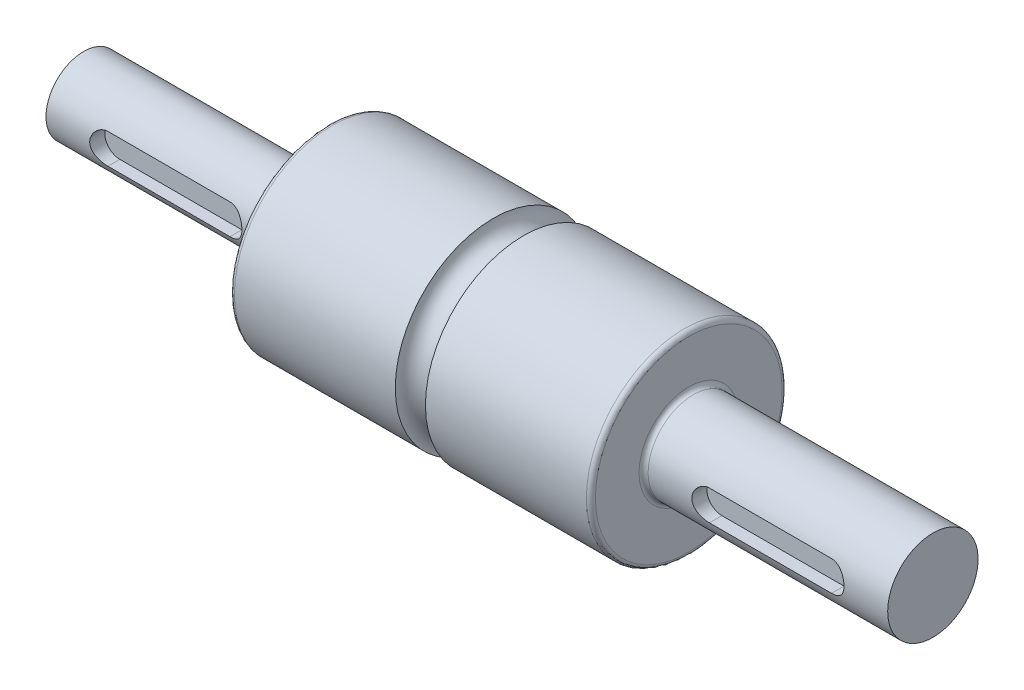
from build123d import *

# Parameters (mm, degrees)
CORTAR_EXTRUIR2_START = 12.5
CORTAR_EXTRUIR2_DEPTH = 5
CORTAR_EXTRUIR3_START = 15
CORTAR_EXTRUIR3_DEPTH = 5


with BuildPart() as part:
    # Croquis4 → Revolución2 (revolve)
    with BuildSketch(Plane(origin=(0, 0, 0), x_dir=(1, 0, 0), z_dir=(0, 1, 0)), mode=Mode.PRIVATE) as revoluci_n2_sk:
        with BuildLine():
            Line((-140.903426942, 0), (-140.903426942, 12.5))
            Line((-140.903426942, 12.5), (-61.403426942, 12.5))
            ThreePointArc((-61.403426942, 12.5), (-60.34276677, 12.939339828), (-59.903426942, 14))
            Line((-59.903426942, 14), (-59.903426942, 31))
            ThreePointArc((-59.903426942, 31), (-59.464087114, 32.060660172), (-58.403426942, 32.5))
            Line((-58.403426942, 32.5), (-5, 32.5))
            ThreePointArc((-5, 32.5), (0, 27.5), (5, 32.5))
            Line((5, 32.5), (58.403426942, 32.5))
            ThreePointArc((58.403426942, 32.5), (59.464087114, 32.060660172), (59.903426942, 31))
            Line((59.903426942, 31), (59.903426942, 16.5))
            ThreePointArc((59.903426942, 16.5), (60.34276677, 15.439339828), (61.403426942, 15))
            Line((61.403426942, 15), (140.903426942, 15))
            Line((140.903426942, 15), (140.903426942, 0))
            Line((140.903426942, 0), (-140.903426942, 0))
        make_face()
    revolve(revoluci_n2_sk.sketch.rotate(Axis((-140.903426942, 0, 0), (1, 0, 0)), 180), axis=Axis((-140.903426942, 0, 0), (1, 0, 0)))

    # Croquis5 → Cortar-Extruir2 (cut)
    with BuildSketch(Plane.XY.offset(CORTAR_EXTRUIR2_START)):
        with BuildLine():
            Line((-121.403426942, -5), (-80.903426942, -5))
            ThreePointArc((-80.903426942, -5), (-75.903426942, 0), (-80.903426942, 5))
            Line((-80.903426942, 5), (-121.403426942, 5))
            ThreePointArc((-121.403426942, 5), (-126.403426942, 0), (-121.403426942, -5))
        make_face()
    extrude(amount=-CORTAR_EXTRUIR2_DEPTH, mode=Mode.SUBTRACT)

    # Croquis6 → Cortar-Extruir3 (cut)
    with BuildSketch(Plane.XY.offset(CORTAR_EXTRUIR3_START)):
        with BuildLine():
            Line((80.903426942, 5), (121.403426942, 5))
            ThreePointArc((121.403426942, 5), (126.403426942, 0), (121.403426942, -5))
            Line((121.403426942, -5), (80.903426942, -5))
            ThreePointArc((80.903426942, -5), (75.903426942, 0), (80.903426942, 5))
        make_face()
    extrude(amount=-CORTAR_EXTRUIR3_DEPTH, mode=Mode.SUBTRACT)


solid = part.part
